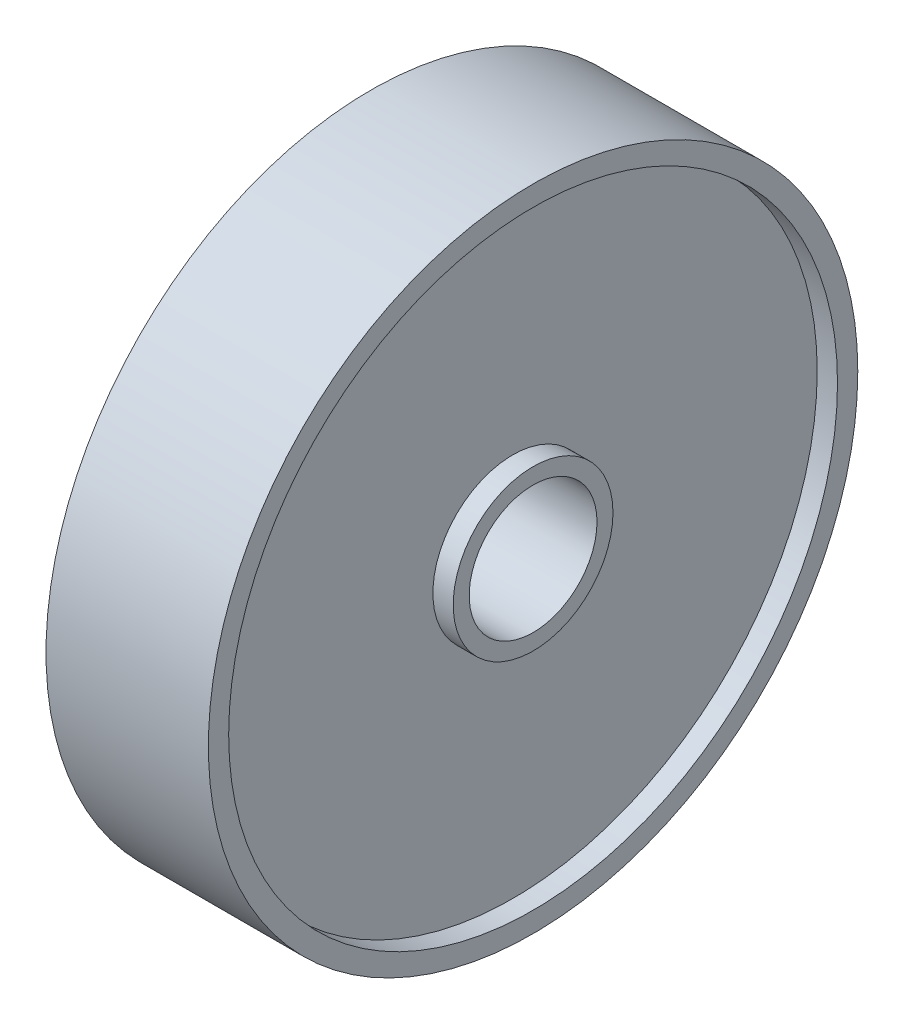
from build123d import *

# Parameters (mm, degrees)
SKETCH1_R           = 101.6
SKETCH1_R_2         = 20
BOSS_EXTRUDE1_DEPTH = 50.8
SKETCH2_R           = 95.25
SKETCH2_R_2         = 25
CUT_EXTRUDE1_DEPTH  = 6.35
CUT_EXTRUDE2_START  = -6.35
SKETCH3_R           = 95.25
SKETCH3_R_2         = 25
CUT_EXTRUDE2_DEPTH  = 6.35


with BuildPart() as part:
    # Sketch1 → Boss-Extrude1 (new body)
    with BuildSketch(Plane(origin=(0, 0, 0), x_dir=(0, 0, -1), z_dir=(1, 0, 0))):
        Circle(SKETCH1_R)
        Circle(SKETCH1_R_2, mode=Mode.SUBTRACT)
    extrude(amount=BOSS_EXTRUDE1_DEPTH)

    # Sketch2 → Cut-Extrude1 (cut)
    with BuildSketch(Plane.ZY):
        Circle(SKETCH2_R)
        Circle(SKETCH2_R_2, mode=Mode.SUBTRACT)
    extrude(amount=-CUT_EXTRUDE1_DEPTH, mode=Mode.SUBTRACT)

    # Sketch3 → Cut-Extrude2 (cut)
    with BuildSketch(Plane(origin=(50.8, 0, 0), x_dir=(0, 0, -1), z_dir=(1, 0, 0)).offset(CUT_EXTRUDE2_START)):
        with Locations(Location((0, 0, 0), (0, 0, 180))):
            Circle(SKETCH3_R)
        with Locations(Location((0, 0, 0), (0, 0, 180))):
            Circle(SKETCH3_R_2, mode=Mode.SUBTRACT)
    extrude(amount=CUT_EXTRUDE2_DEPTH, mode=Mode.SUBTRACT)


solid = part.part
